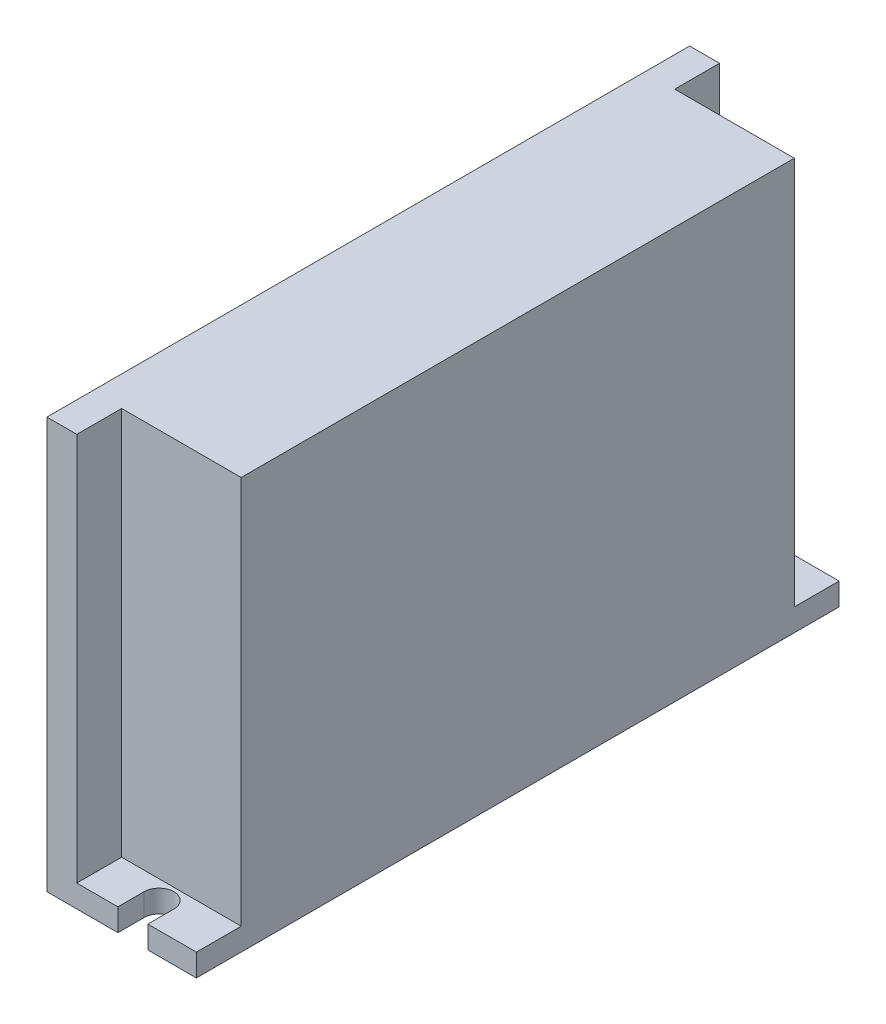
from build123d import *

# Parameters (mm, degrees)
SKETCH1_W           = 20
SKETCH1_H           = 86
BOSS_EXTRUDE1_DEPTH = 3
CUT_EXTRUDE1_DEPTH  = 45.24929378
SKETCH3_W           = 4
SKETCH3_H           = 86
BOSS_EXTRUDE2_DEPTH = 52
SKETCH4_W           = 16
SKETCH4_H           = 74
BOSS_EXTRUDE3_DEPTH = 52


with BuildPart() as part:
    # Sketch1 → Boss-Extrude1 (new body)
    with BuildSketch(Plane(origin=(0, 0, 0), x_dir=(1, 0, 0), z_dir=(0, 1, 0))):
        Rectangle(SKETCH1_W, SKETCH1_H)
    extrude(amount=BOSS_EXTRUDE1_DEPTH)

    # Sketch2 → Cut-Extrude1 (cut, through all)
    with BuildSketch(Plane(origin=(0, 3, 0), x_dir=(1, 0, 0), z_dir=(0, 1, 0))):
        with BuildLine():
            Line((-0.5, 39.5), (-0.5, 43))
            Line((-0.5, 43), (3.5, 43))
            Line((3.5, 43), (3.5, 39.5))
            ThreePointArc((3.5, 39.5), (1.5, 37.5), (-0.5, 39.5))
        make_face()
        with BuildLine():
            Line((-0.5, -39.5), (-0.5, -43))
            Line((-0.5, -43), (3.5, -43))
            Line((3.5, -43), (3.5, -39.5))
            ThreePointArc((3.5, -39.5), (1.5, -37.5), (-0.5, -39.5))
        make_face()
    extrude(amount=-CUT_EXTRUDE1_DEPTH, mode=Mode.SUBTRACT)

    # Sketch3 → Boss-Extrude2 (add)
    with BuildSketch(Plane(origin=(0, 3, 0), x_dir=(1, 0, 0), z_dir=(0, 1, 0))):
        with Locations((-8, 0)):
            Rectangle(SKETCH3_W, SKETCH3_H)
    extrude(amount=BOSS_EXTRUDE2_DEPTH)

    # Sketch4 → Boss-Extrude3 (add)
    with BuildSketch(Plane(origin=(0, 3, 0), x_dir=(1, 0, 0), z_dir=(0, 1, 0))):
        with Locations((2, 0)):
            Rectangle(SKETCH4_W, SKETCH4_H)
    extrude(amount=BOSS_EXTRUDE3_DEPTH)


solid = part.part
